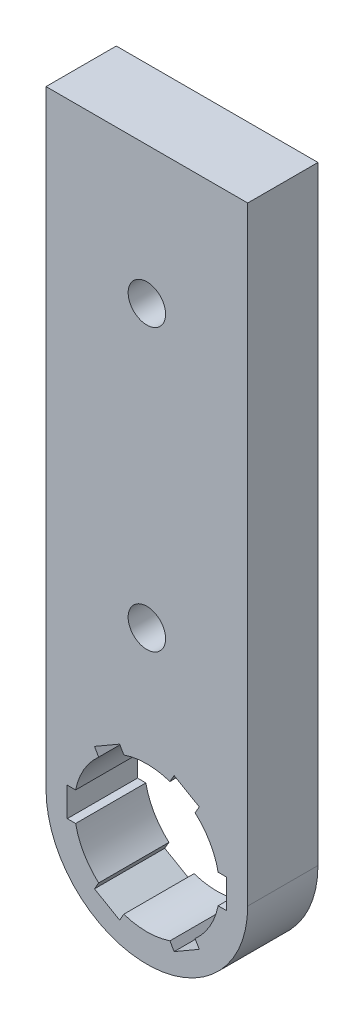
from build123d import *

# Parameters (mm, degrees)
SKETCH1_R           = 4.765
SKETCH1_R_2         = 2
BOSS_EXTRUDE1_DEPTH = 7.5
CUT_EXTRUDE1_START  = -7.5
SKETCH3_R           = 7.765
SKETCH3_W           = 17
SKETCH3_H           = 3.1
CUT_EXTRUDE1_DEPTH  = 7.5


with BuildPart() as part:
    # Sketch1 → Boss-Extrude1 (new body)
    with BuildSketch(Plane.XY):
        with BuildLine():
            Line((-10.765, 32.5), (10.765, 32.5))
            Line((10.765, 32.5), (10.765, -32.5))
            ThreePointArc((10.765, -32.5), (0, -43.265), (-10.765, -32.5))
            Line((-10.765, -32.5), (-10.765, 32.5))
        make_face()
        with Locations((0, -32.5)):
            Circle(SKETCH1_R, mode=Mode.SUBTRACT)
        with Locations((0, 17.835)):
            Circle(SKETCH1_R_2, mode=Mode.SUBTRACT)
        with Locations(Location((0, -12.165, 0), (0, 0, 180))):
            Circle(SKETCH1_R_2, mode=Mode.SUBTRACT)
    extrude(amount=BOSS_EXTRUDE1_DEPTH)

    # Sketch3 → Cut-Extrude1 (cut)
    with BuildSketch(Plane.XY.offset(7.5).offset(CUT_EXTRUDE1_START)):
        with Locations((0, -32.5)):
            Circle(SKETCH3_R)
        Polygon((-5.592339376, -25.913784068), (-2.907660624, -24.363784068), (5.592339376, -39.086215932), (2.907660624, -40.636215932), align=None)
        with Locations((0, -32.5)):
            Rectangle(SKETCH3_W, SKETCH3_H)
        Polygon((2.907660624, -24.363784068), (5.592339376, -25.913784068), (-2.907660624, -40.636215932), (-5.592339376, -39.086215932), align=None)
    extrude(amount=CUT_EXTRUDE1_DEPTH, mode=Mode.SUBTRACT)


solid = part.part
